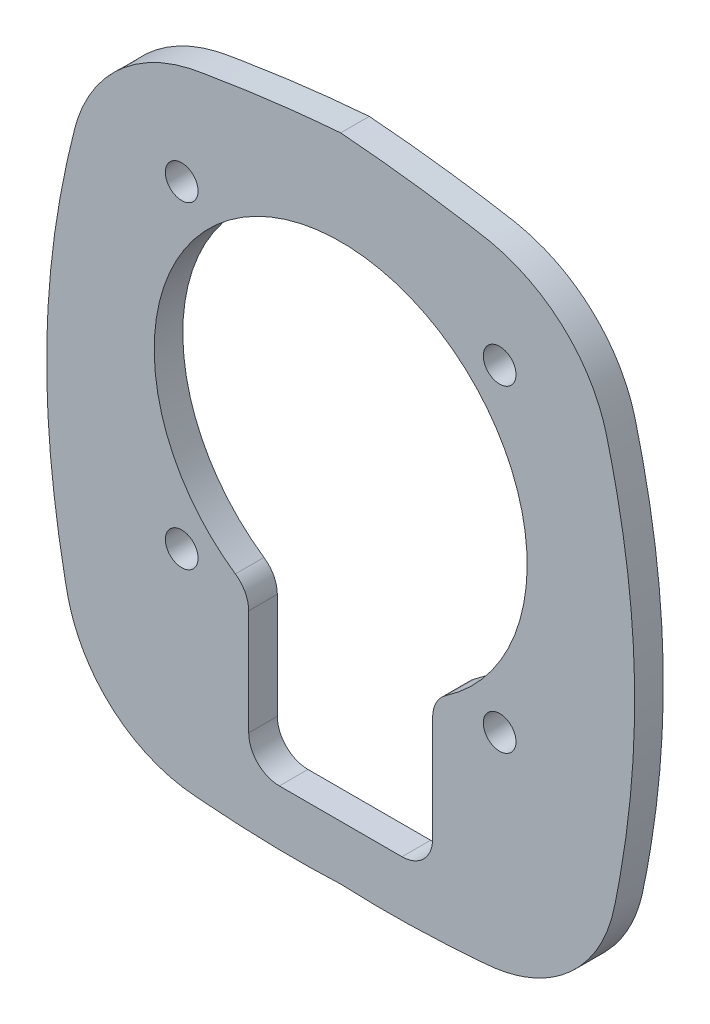
from build123d import *

# Parameters (mm, degrees)
SKETCH_1_R      = 1.6
EXTRUDE_1_DEPTH = 1.4


with BuildPart() as part:
    # Эскиз1 → Бобышка-Вытянуть1 (new, symmetric)
    with BuildSketch(Plane.XY):
        with BuildLine():
            add(Edge.make_bspline(
                [(0, 131.106222882), (-0.370220785, 131.076347993), (-1.102779578, 131.017234316), (-2.189060224, 130.919624595), (-3.443637711, 130.798467833), (-4.881735459, 130.646269922), (-6.503020503, 130.456312253), (-8.12495085, 130.247392322), (-9.741711108, 130.020630526), (-11.36281695, 129.775036484), (-12.676015392, 129.561961331), (-13.68967903, 129.390078582), (-14.413232864, 129.264584839), (-15.159625099, 129.094362093), (-15.928185443, 128.880405682), (-16.715163254, 128.616368934), (-17.516348702, 128.298628961), (-18.326688606, 127.922941878), (-19.728048414, 127.169724573), (-21.747987535, 125.727575964), (-23.567693799, 123.700004581), (-24.612712681, 122.011346521), (-25.101312847, 121.04901032), (-25.462593655, 120.225148914), (-25.738909462, 119.460763634), (-25.94677143, 118.767454031), (-26.081687876, 118.239687864), (-26.212908569, 117.717370422), (-26.550773375, 116.339124971), (-27.062440519, 114.066420204), (-27.653164131, 110.922560067), (-28.131235228, 107.713696234), (-28.475274231, 104.545836759), (-28.699132748, 101.293497056), (-28.820606115, 96.997365467), (-28.681457815, 92.743441744), (-28.310546102, 88.465729648), (-28.011412762, 86.039840672), (-27.687188607, 83.821524975), (-27.446887043, 82.351713486), (-27.170364704, 80.822297117), (-26.964445801, 79.763919621), (-26.795893016, 78.905610826), (-26.639789871, 78.227638137), (-26.496238435, 77.706670532), (-26.315714678, 77.126427714), (-26.080412167, 76.474242148), (-25.653035676, 75.47125893), (-25.021169521, 74.284763335), (-23.797814677, 72.515816398), (-22.274906789, 70.980648572), (-20.507858139, 69.748039699), (-19.073299489, 68.983497976), (-17.565682132, 68.396534243), (-16.374108839, 68.085794929), (-15.540656532, 67.931878814), (-15.058842612, 67.858658077), (-14.543170425, 67.797527545), (-13.993799753, 67.752137476), (-13.412264546, 67.704717217), (-12.688945313, 67.650229305), (-11.804304984, 67.589091763), (-10.73880925, 67.52411052), (-8.932087435, 67.42921281), (-6.950627599, 67.36001138), (-4.815403254, 67.335396808), (-3.186397421, 67.342670006), (-1.577573114, 67.374694658), (-0.508566905, 67.421110428), (0, 67.443192175)],
                knots=[0, 0, 0, 0, 0.010771191, 0.02131304, 0.031628454, 0.047322767, 0.063249599, 0.078966036, 0.094746057, 0.11059324, 0.126513589, 0.133325198, 0.140410134, 0.147805883, 0.155515432, 0.163537099, 0.171866609, 0.180497955, 0.189423614, 0.217985674, 0.251992716, 0.267592695, 0.275472244, 0.283274722, 0.293667804, 0.299018776, 0.304259573, 0.309463091, 0.314637016, 0.345411575, 0.377006574, 0.407382407, 0.439472665, 0.469388094, 0.50189901, 0.564078892, 0.592670464, 0.626403664, 0.634940925, 0.657684734, 0.669589076, 0.680011587, 0.688953116, 0.694953853, 0.700182096, 0.704619949, 0.712574345, 0.720275767, 0.736225015, 0.751452289, 0.78255157, 0.798227668, 0.813816479, 0.82957521, 0.845040558, 0.849440511, 0.854151769, 0.859170891, 0.864496245, 0.87013637, 0.876091626, 0.885531561, 0.8958518, 0.907047779, 0.937998223, 0.953339227, 0.968970642, 0.985238155, 1, 1, 1, 1], degree=3))
            add(Edge.make_bspline(
                [(0, 67.443192175), (0.249821364, 67.431628062), (0.762662013, 67.40788891), (1.552151885, 67.380688451), (2.38158192, 67.359162124), (3.492443713, 67.340799343), (4.860854811, 67.335584203), (7.017688253, 67.361429059), (9.206266825, 67.439481423), (11.360555129, 67.559242305), (12.742830846, 67.652471284), (13.828642073, 67.738350945), (14.670177097, 67.806690644), (15.433665488, 67.910835289), (16.43715099, 68.097635371), (17.7023193, 68.441566796), (19.19906457, 69.04219543), (20.619754867, 69.817813812), (22.370543972, 71.063544766), (23.879054895, 72.612317775), (25.087984722, 74.395533827), (25.708103716, 75.586617657), (26.125541169, 76.590715807), (26.381172043, 77.319435939), (26.610332418, 78.098259903), (26.771259587, 78.796324954), (26.904003327, 79.460947792), (27.019377268, 80.04101619), (27.141224488, 80.6773507), (27.269461333, 81.369952952), (27.48482909, 82.581967896), (27.69853251, 83.895434571), (28.020991969, 86.109477736), (28.322099842, 88.575755775), (28.688440492, 92.86238598), (28.82169129, 97.132197747), (28.691853506, 101.444329278), (28.461147635, 104.703501922), (28.11041252, 107.874360128), (27.625487332, 111.086050261), (27.027115418, 114.236733399), (26.490376549, 116.600816702), (26.103003987, 118.15804878), (25.921243346, 118.866835156), (25.677595437, 119.639466291), (25.110109967, 121.14785111), (23.832711812, 123.43277094), (21.622994104, 125.838661408), (19.585309988, 127.259620437), (18.176655717, 127.99690654), (17.365078488, 128.362625042), (16.563395265, 128.670990381), (15.776455467, 128.926042141), (15.008483475, 129.131941856), (14.262643492, 129.293613738), (13.540279292, 129.415036674), (12.534500053, 129.585694823), (11.23493113, 129.794831482), (9.103598592, 130.116248501), (6.966209264, 130.402556522), (4.828909424, 130.65214503), (3.228804537, 130.820700086), (1.621804658, 130.97375985), (0.54635647, 131.061598497), (0, 131.106222882)],
                knots=[0, 0, 0, 0, 0.007252899, 0.014888965, 0.022909471, 0.031315438, 0.047109596, 0.062593786, 0.093869192, 0.110611185, 0.125167253, 0.134046281, 0.142201111, 0.14964863, 0.156381348, 0.171795973, 0.187580878, 0.203048579, 0.21862316, 0.249784285, 0.265041537, 0.281007318, 0.288624024, 0.296566116, 0.30339124, 0.312158749, 0.317330326, 0.323047655, 0.329310904, 0.336120154, 0.34347537, 0.365011642, 0.37470932, 0.408363303, 0.437047062, 0.499467311, 0.532105703, 0.562131004, 0.594200646, 0.624600263, 0.656307776, 0.687187957, 0.694889722, 0.702849025, 0.708402608, 0.718376373, 0.749561686, 0.78361641, 0.812211035, 0.821107497, 0.829710036, 0.838011553, 0.846006084, 0.853689891, 0.861061349, 0.86812915, 0.874930843, 0.890648177, 0.906302189, 0.937440768, 0.953185002, 0.968706837, 0.984102235, 1, 1, 1, 1], degree=3))
        make_face()
        with Locations((15.556349186, 119.193294207)):
            Circle(SKETCH_1_R, mode=Mode.SUBTRACT)
        with Locations(Location((15.556349186, 88.080595835, 0), (0, 0, 180))):
            Circle(SKETCH_1_R, mode=Mode.SUBTRACT)
        with Locations((-15.556349186, 88.080595835)):
            Circle(SKETCH_1_R, mode=Mode.SUBTRACT)
        with Locations(Location((-15.556349186, 119.193294207, 0), (0, 0, 180))):
            Circle(SKETCH_1_R, mode=Mode.SUBTRACT)
        with BuildLine():
            Line((-6, 72.760468711), (6, 72.760468711))
            ThreePointArc((6, 72.760468711), (8.121320344, 73.639148368), (9, 75.760468711))
            Line((9, 75.760468711), (9, 86.099485113))
            ThreePointArc((9, 86.099485113), (9.346478477, 87.499064882), (10.305882353, 88.575361806))
            ThreePointArc((10.305882353, 88.575361806), (0, 121.886945021), (-10.305882353, 88.575361806))
            ThreePointArc((-10.305882353, 88.575361806), (-9.346478477, 87.499064882), (-9, 86.099485113))
            Line((-9, 86.099485113), (-9, 75.760468711))
            ThreePointArc((-9, 75.760468711), (-8.121320344, 73.639148368), (-6, 72.760468711))
        make_face(mode=Mode.SUBTRACT)
    extrude(amount=EXTRUDE_1_DEPTH, both=True)


solid = part.part
